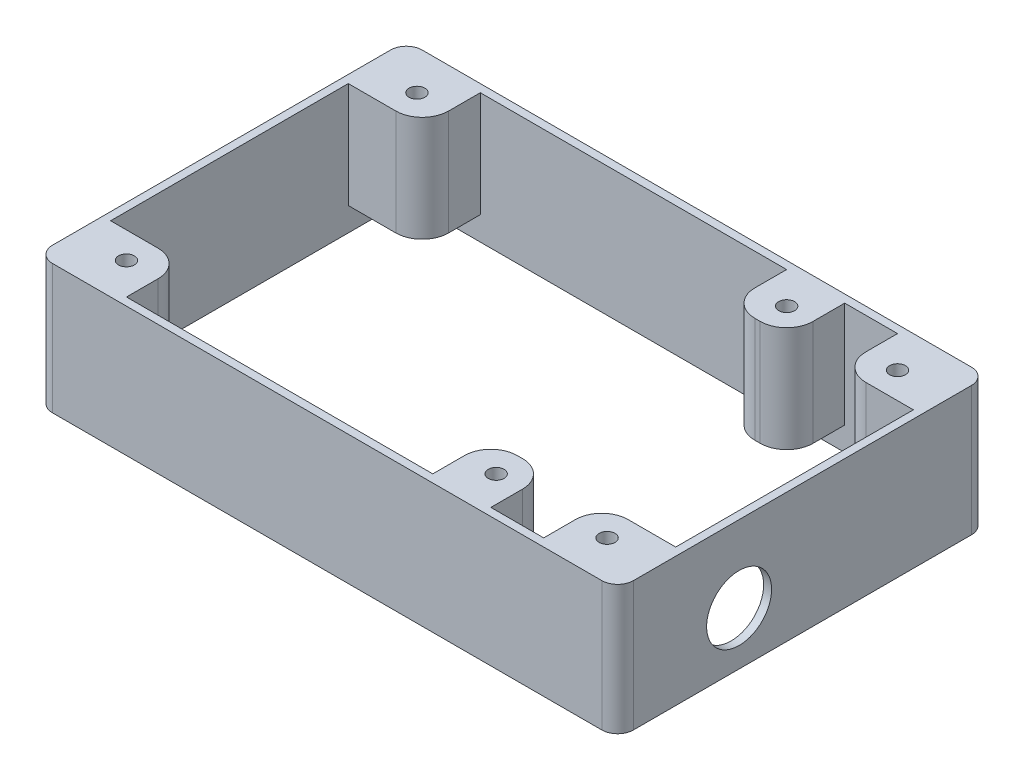
from build123d import *

# Parameters (mm, degrees)
BOSS_EXTRUDE1_DEPTH  = 2.5
BOSS_EXTRUDE6_DEPTH  = 24.5
CUT_EXTRUDE7_REACH   = 72.562
SKETCH3_R            = 2.5
BOSS_EXTRUDE11_START = -24.5
SKETCH12_R           = 1.5
BOSS_EXTRUDE11_DEPTH = 20
CUT_EXTRUDE11_REACH  = 120.55
SKETCH13_R           = 6.15
BOSS_EXTRUDE13_START = -4.5
SKETCH12_5_R         = 1.5
BOSS_EXTRUDE13_DEPTH = 2
CUT_EXTRUDE13_DEPTH  = 2.5


with BuildPart() as part:
    # Sketch1 → Boss-Extrude1 (new body)
    with BuildSketch(Plane(origin=(0, 0, 0), x_dir=(1, 0, 0), z_dir=(0, 1, 0))):
        with BuildLine():
            Line((-52, -35), (52, -35))
            ThreePointArc((52, -35), (54.121320344, -34.121320344), (55, -32))
            Line((55, -32), (55, 32))
            ThreePointArc((55, 32), (54.121320344, 34.121320344), (52, 35))
            Line((52, 35), (-52, 35))
            ThreePointArc((-52, 35), (-54.121320344, 34.121320344), (-55, 32))
            Line((-55, 32), (-55, -32))
            ThreePointArc((-55, -32), (-54.121320344, -34.121320344), (-52, -35))
        make_face()
    extrude(amount=-BOSS_EXTRUDE1_DEPTH)

    # Sketch7 → Boss-Extrude6 (add)
    with BuildSketch(Plane.XZ.offset(2.5)):
        with BuildLine():
            Line((-55, 32), (-55, -32))
            ThreePointArc((-55, -32), (-54.121320344, -34.121320344), (-52, -35))
            Line((-52, -35), (52, -35))
            ThreePointArc((52, -35), (54.121320344, -34.121320344), (55, -32))
            Line((55, -32), (55, 32))
            ThreePointArc((55, 32), (54.121320344, 34.121320344), (52, 35))
            Line((52, 35), (-52, 35))
            ThreePointArc((-52, 35), (-54.121320344, 34.121320344), (-55, 32))
        make_face()
        with BuildLine():
            Line((-53.5, 32), (-53.5, -32))
            ThreePointArc((-53.5, -32), (-53.060660172, -33.060660172), (-52, -33.5))
            Line((-52, -33.5), (52, -33.5))
            ThreePointArc((52, -33.5), (53.060660172, -33.060660172), (53.5, -32))
            Line((53.5, -32), (53.5, 32))
            ThreePointArc((53.5, 32), (53.060660172, 33.060660172), (52, 33.5))
            Line((52, 33.5), (-52, 33.5))
            ThreePointArc((-52, 33.5), (-53.060660172, 33.060660172), (-53.5, 32))
        make_face(mode=Mode.SUBTRACT)
    extrude(amount=BOSS_EXTRUDE6_DEPTH)

    # Sketch3 → Cut-Extrude7 (cut, up to next)
    with BuildSketch(Plane(origin=(0, 0, 0), x_dir=(1, 0, 0), z_dir=(0, 1, 0)), mode=Mode.PRIVATE) as cut_extrude7_sk1:
        with Locations(Location((-20.1, -27.5, 0), (0, 0, 270))):
            Circle(SKETCH3_R)
    cut_extrude7_tool1 = extrude(cut_extrude7_sk1.sketch, amount=-CUT_EXTRUDE7_REACH, mode=Mode.PRIVATE) & part.part
    # Sketch3 → Cut-Extrude7 (cut, up to next)
    with BuildSketch(Plane(origin=(0, 0, 0), x_dir=(1, 0, 0), z_dir=(0, 1, 0)), mode=Mode.PRIVATE) as cut_extrude7_sk2:
        with Locations(Location((-9.6, -27.5, 0), (0, 0, 270))):
            Circle(SKETCH3_R)
    cut_extrude7_tool2 = extrude(cut_extrude7_sk2.sketch, amount=-CUT_EXTRUDE7_REACH, mode=Mode.PRIVATE) & part.part
    # Sketch3 → Cut-Extrude7 (cut, up to next)
    with BuildSketch(Plane(origin=(0, 0, 0), x_dir=(1, 0, 0), z_dir=(0, 1, 0)), mode=Mode.PRIVATE) as cut_extrude7_sk3:
        with Locations(Location((0.5, -27.5, 0), (0, 0, 270))):
            Circle(SKETCH3_R)
    cut_extrude7_tool3 = extrude(cut_extrude7_sk3.sketch, amount=-CUT_EXTRUDE7_REACH, mode=Mode.PRIVATE) & part.part
    # Sketch3 → Cut-Extrude7 (cut, up to next)
    with BuildSketch(Plane(origin=(0, 0, 0), x_dir=(1, 0, 0), z_dir=(0, 1, 0)), mode=Mode.PRIVATE) as cut_extrude7_sk4:
        with Locations(Location((10.5, -27.5, 0), (0, 0, 270))):
            Circle(SKETCH3_R)
    cut_extrude7_tool4 = extrude(cut_extrude7_sk4.sketch, amount=-CUT_EXTRUDE7_REACH, mode=Mode.PRIVATE) & part.part
    add(cut_extrude7_tool1.solids().sort_by_distance((-20.1, 0, 27.5))[0], mode=Mode.SUBTRACT)
    add(cut_extrude7_tool2.solids().sort_by_distance((-9.6, 0, 27.5))[0], mode=Mode.SUBTRACT)
    add(cut_extrude7_tool3.solids().sort_by_distance((0.5, 0, 27.5))[0], mode=Mode.SUBTRACT)
    add(cut_extrude7_tool4.solids().sort_by_distance((10.5, 0, 27.5))[0], mode=Mode.SUBTRACT)

    # Sketch12 → Boss-Extrude11 (add)
    # profile 1 of 6: a face of its own
    with BuildSketch(Plane.XZ.offset(27).offset(BOSS_EXTRUDE11_START)):
        with BuildLine():
            Line((-39.5, 27.5), (-39.5, 33.5))
            Line((-39.5, 33.5), (-52, 33.5))
            ThreePointArc((-52, 33.5), (-53.060660172, 33.060660172), (-53.5, 32))
            Line((-53.5, 32), (-53.5, 22.5))
            Line((-53.5, 22.5), (-44.5, 22.5))
            ThreePointArc((-44.5, 22.5), (-40.964466094, 23.964466094), (-39.5, 27.5))
        make_face()
        with Locations(Location((-45.5, 27.5, 0), (0, 0, 270))):
            Circle(SKETCH12_R, mode=Mode.SUBTRACT)
    # profile 2 of 6: a face of its own
    with BuildSketch(Plane.XZ.offset(27).offset(BOSS_EXTRUDE11_START)):
        with BuildLine():
            Line((29.5, 33.5), (18.5, 33.5))
            Line((18.5, 33.5), (18.5, 27.5))
            ThreePointArc((18.5, 27.5), (19.964466094, 23.964466094), (23.5, 22.5))
            Line((23.5, 22.5), (24.5, 22.5))
            ThreePointArc((24.5, 22.5), (28.035533906, 23.964466094), (29.5, 27.5))
            Line((29.5, 27.5), (29.5, 33.5))
        make_face()
        with Locations(Location((24.5, 27.5, 0), (0, 0, 270))):
            Circle(SKETCH12_R, mode=Mode.SUBTRACT)
    # profile 3 of 6: a face of its own
    with BuildSketch(Plane.XZ.offset(27).offset(BOSS_EXTRUDE11_START)):
        with BuildLine():
            Line((18.5, -27.5), (18.5, -33.5))
            Line((18.5, -33.5), (29.5, -33.5))
            Line((29.5, -33.5), (29.5, -27.5))
            ThreePointArc((29.5, -27.5), (28.035533906, -23.964466094), (24.5, -22.5))
            Line((24.5, -22.5), (23.5, -22.5))
            ThreePointArc((23.5, -22.5), (19.964466094, -23.964466094), (18.5, -27.5))
        make_face()
        with Locations(Location((24.5, -27.5, 0), (0, 0, 270))):
            Circle(SKETCH12_R, mode=Mode.SUBTRACT)
    # profile 4 of 6: a face of its own
    with BuildSketch(Plane.XZ.offset(27).offset(BOSS_EXTRUDE11_START)):
        with BuildLine():
            Line((-44.5, -22.5), (-53.5, -22.5))
            Line((-53.5, -22.5), (-53.5, -32))
            ThreePointArc((-53.5, -32), (-53.060660172, -33.060660172), (-52, -33.5))
            Line((-52, -33.5), (-39.5, -33.5))
            Line((-39.5, -33.5), (-39.5, -27.5))
            ThreePointArc((-39.5, -27.5), (-40.964466094, -23.964466094), (-44.5, -22.5))
        make_face()
        with Locations(Location((-45.5, -27.5, 0), (0, 0, 270))):
            Circle(SKETCH12_R, mode=Mode.SUBTRACT)
    # profile 5 of 6: a face of its own
    with BuildSketch(Plane.XZ.offset(27).offset(BOSS_EXTRUDE11_START)):
        with BuildLine():
            Line((52, 33.5), (39.5, 33.5))
            Line((39.5, 33.5), (39.5, 27.5))
            ThreePointArc((39.5, 27.5), (40.964466094, 23.964466094), (44.5, 22.5))
            Line((44.5, 22.5), (53.5, 22.5))
            Line((53.5, 22.5), (53.5, 32))
            ThreePointArc((53.5, 32), (53.060660172, 33.060660172), (52, 33.5))
        make_face()
        with Locations(Location((45.5, 27.5, 0), (0, 0, 270))):
            Circle(SKETCH12_R, mode=Mode.SUBTRACT)
    # profile 6 of 6: a face of its own
    with BuildSketch(Plane.XZ.offset(27).offset(BOSS_EXTRUDE11_START)):
        with BuildLine():
            Line((53.5, -32), (53.5, -22.5))
            Line((53.5, -22.5), (44.5, -22.5))
            ThreePointArc((44.5, -22.5), (40.964466094, -23.964466094), (39.5, -27.5))
            Line((39.5, -27.5), (39.5, -33.5))
            Line((39.5, -33.5), (52, -33.5))
            ThreePointArc((52, -33.5), (53.060660172, -33.060660172), (53.5, -32))
        make_face()
        with Locations(Location((45.5, -27.5, 0), (0, 0, 270))):
            Circle(SKETCH12_R, mode=Mode.SUBTRACT)
    extrude(amount=BOSS_EXTRUDE11_DEPTH)

    # Sketch13 → Cut-Extrude11 (cut, up to next)
    with BuildSketch(Plane(origin=(55, 0, 0), x_dir=(0, 0, -1), z_dir=(1, 0, 0)), mode=Mode.PRIVATE) as cut_extrude11_sk1:
        with Locations((-12, -17)):
            Circle(SKETCH13_R)
    cut_extrude11_tool1 = extrude(cut_extrude11_sk1.sketch, amount=-CUT_EXTRUDE11_REACH, mode=Mode.PRIVATE) & part.part
    add(cut_extrude11_tool1.solids().sort_by_distance((55, -17, 12))[0], mode=Mode.SUBTRACT)

    # Sketch12<5> → Boss-Extrude13 (add)
    # profile 1 of 2: a face of its own
    with BuildSketch(Plane.XZ.offset(27).offset(BOSS_EXTRUDE13_START)):
        with BuildLine():
            Line((44.5, 22.5), (53.5, 22.5))
            Line((53.5, 22.5), (53.5, 32))
            ThreePointArc((53.5, 32), (53.060660172, 33.060660172), (52, 33.5))
            Line((52, 33.5), (39.5, 33.5))
            Line((39.5, 33.5), (39.5, 27.5))
            ThreePointArc((39.5, 27.5), (40.964466094, 23.964466094), (44.5, 22.5))
        make_face()
        with Locations(Location((45.5, 27.5, 0), (0, 0, 270))):
            Circle(SKETCH12_5_R, mode=Mode.SUBTRACT)
    # profile 2 of 2: a face of its own
    with BuildSketch(Plane.XZ.offset(27).offset(BOSS_EXTRUDE13_START)):
        with BuildLine():
            Line((39.5, -27.5), (39.5, -33.5))
            Line((39.5, -33.5), (52, -33.5))
            ThreePointArc((52, -33.5), (53.060660172, -33.060660172), (53.5, -32))
            Line((53.5, -32), (53.5, -22.5))
            Line((53.5, -22.5), (44.5, -22.5))
            ThreePointArc((44.5, -22.5), (40.964466094, -23.964466094), (39.5, -27.5))
        make_face()
        with Locations(Location((45.5, -27.5, 0), (0, 0, 270))):
            Circle(SKETCH12_5_R, mode=Mode.SUBTRACT)
    extrude(amount=BOSS_EXTRUDE13_DEPTH)

    # Sketch14 → Cut-Extrude13 (cut)
    with BuildSketch(Plane(origin=(0, 0, 0), x_dir=(1, 0, 0), z_dir=(0, 1, 0))):
        with BuildLine():
            Line((-52, -35), (52, -35))
            ThreePointArc((52, -35), (54.121320344, -34.121320344), (55, -32))
            Line((55, -32), (55, 32))
            ThreePointArc((55, 32), (54.121320344, 34.121320344), (52, 35))
            Line((52, 35), (-52, 35))
            ThreePointArc((-52, 35), (-54.121320344, 34.121320344), (-55, 32))
            Line((-55, 32), (-55, -32))
            ThreePointArc((-55, -32), (-54.121320344, -34.121320344), (-52, -35))
        make_face()
    extrude(amount=-CUT_EXTRUDE13_DEPTH, mode=Mode.SUBTRACT)


solid = part.part
